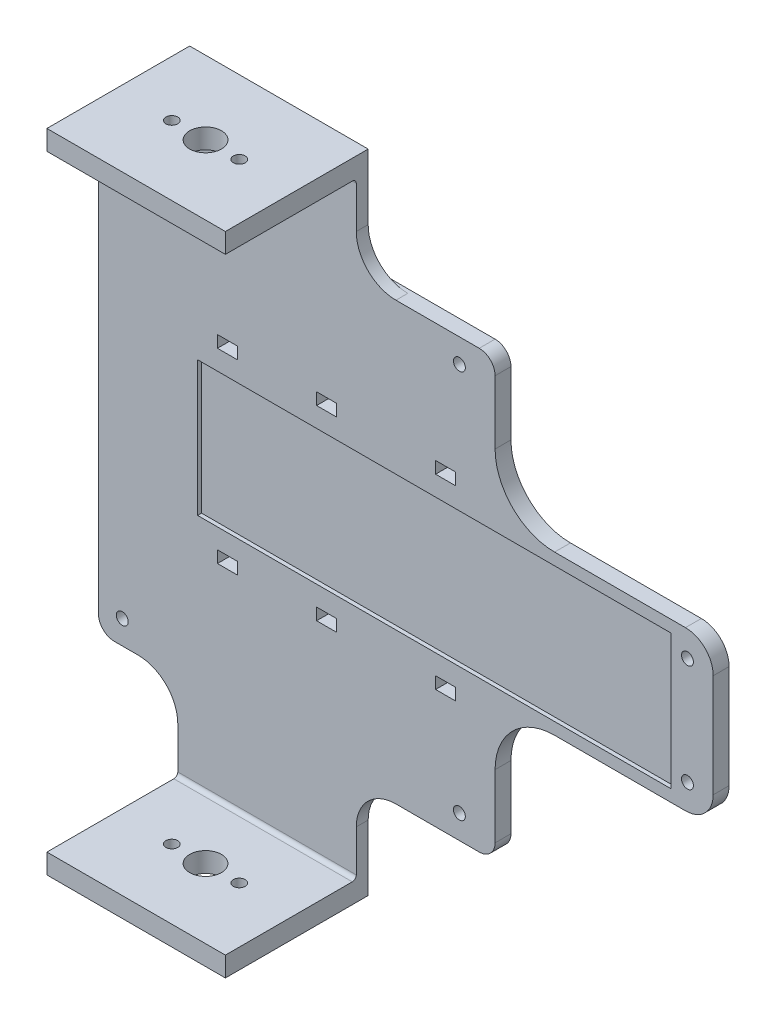
from build123d import *

# Parameters (mm, degrees)
SKETCH1_W           = 155
SKETCH1_H           = 110
BOSS_EXTRUDE1_DEPTH = 4
SKETCH2_W           = 55
SKETCH2_H           = 35
SKETCH2_R           = 1.5
CUT_EXTRUDE1_DEPTH  = 148
FILLET2_R           = 15
FILLET3_R           = 7
SKETCH3_W           = 45
SKETCH3_H           = 26.5
BOSS_EXTRUDE2_DEPTH = 3
SKETCH5_W           = 45
SKETCH5_H           = 5
BOSS_EXTRUDE3_DEPTH = 33
SKETCH6_R           = 4
SKETCH6_R_2         = 1.5
CUT_EXTRUDE2_DEPTH  = 223
FILLET4_R           = 10
FILLET5_R           = 1
SKETCH9_W           = 119.31184044
SKETCH9_H           = 34
CUT_EXTRUDE4_DEPTH  = 1
FILLET8_R           = 4
SKETCH10_W          = 5
SKETCH10_H          = 3
CUT_EXTRUDE5_DEPTH  = 4


with BuildPart() as part:
    # Sketch1 → Boss-Extrude1 (new body)
    with BuildSketch(Plane.XY):
        Rectangle(SKETCH1_W, SKETCH1_H)
    extrude(amount=BOSS_EXTRUDE1_DEPTH)

    # Sketch2 → Cut-Extrude1 (cut)
    with BuildSketch(Plane.XY.offset(4)):
        with Locations((50, -37.5)):
            Rectangle(SKETCH2_W, SKETCH2_H)
        with Locations((50, 37.5)):
            Rectangle(SKETCH2_W, SKETCH2_H)
        with Locations((-71.5, 49)):
            Circle(SKETCH2_R)
        with Locations(Location((-71.5, -49, 0), (0, 0, 180))):
            Circle(SKETCH2_R)
        with Locations((71, 13.5)):
            Circle(SKETCH2_R)
        with Locations(Location((71, -13.5, 0), (0, 0, 180))):
            Circle(SKETCH2_R)
        with Locations((13.5, 49)):
            Circle(SKETCH2_R)
        with Locations(Location((13.5, -49, 0), (0, 0, 180))):
            Circle(SKETCH2_R)
    extrude(amount=-CUT_EXTRUDE1_DEPTH, mode=Mode.SUBTRACT)

    # Fillet2
    fillet2_edges = [part.edges().sort_by_distance(p)[0] for p in [
        (22.5, 20, 2),
        (22.5, -20, 2),
    ]]
    fillet(fillet2_edges, radius=FILLET2_R)

    # Fillet3
    fillet3_edges = [part.edges().sort_by_distance(p)[0] for p in [
        (77.5, 20, 2),
        (77.5, -20, 2),
    ]]
    fillet(fillet3_edges, radius=FILLET3_R)

    # Sketch3 → Boss-Extrude2 (add)
    with BuildSketch(Plane.XY.offset(4)):
        with Locations((-35, 68.25)):
            Rectangle(SKETCH3_W, SKETCH3_H)
        with Locations((-35, -68.25)):
            Rectangle(SKETCH3_W, SKETCH3_H)
    extrude(amount=-BOSS_EXTRUDE2_DEPTH)

    # Sketch5 → Boss-Extrude3 (add)
    with BuildSketch(Plane.XY.offset(4)):
        with Locations((-35, 79)):
            Rectangle(SKETCH5_W, SKETCH5_H)
        with Locations((-35, -79)):
            Rectangle(SKETCH5_W, SKETCH5_H)
    extrude(amount=BOSS_EXTRUDE3_DEPTH)

    # Sketch6 → Cut-Extrude2 (cut)
    with BuildSketch(Plane(origin=(0, 81.5, 0), x_dir=(1, 0, 0), z_dir=(0, 1, 0))):
        with Locations(Location((-35, -19.5, 0), (0, 0, 270))):
            Circle(SKETCH6_R)
        with Locations(Location((-43.5, -19.5, 0), (0, 0, 270))):
            Circle(SKETCH6_R_2)
        with Locations(Location((-26.5, -19.5, 0), (0, 0, 270))):
            Circle(SKETCH6_R_2)
    extrude(amount=-CUT_EXTRUDE2_DEPTH, mode=Mode.SUBTRACT)

    # Fillet4
    fillet4_edges = [part.edges().sort_by_distance(p)[0] for p in [
        (-12.5, 55, 2.5),
        (-57.5, 55, 2.5),
        (-57.5, -55, 2.5),
        (-12.5, -55, 2.5),
    ]]
    fillet(fillet4_edges, radius=FILLET4_R)

    # Fillet5
    fillet5_edges = [part.edges().sort_by_distance(p)[0] for p in [
        (-35, 76.5, 4),
        (-35, -76.5, 4),
    ]]
    fillet(fillet5_edges, radius=FILLET5_R)

    # Sketch9 → Cut-Extrude4 (cut)
    with BuildSketch(Plane.XY.offset(4)):
        with Locations((7.15592022, 0)):
            Rectangle(SKETCH9_W, SKETCH9_H)
    extrude(amount=-CUT_EXTRUDE4_DEPTH, mode=Mode.SUBTRACT)

    # Fillet8
    fillet8_edges = [part.edges().sort_by_distance(p)[0] for p in [
        (22.5, 55, 2),
        (22.5, -55, 2),
        (-77.5, 55, 2),
        (-77.5, -55, 2),
    ]]
    fillet(fillet8_edges, radius=FILLET8_R)

    # Sketch10 → Cut-Extrude5 (cut)
    with BuildSketch(Plane.XY.offset(4)):
        with Locations((-45, 23.5)):
            Rectangle(SKETCH10_W, SKETCH10_H)
        with Locations((-20, 23.5)):
            Rectangle(SKETCH10_W, SKETCH10_H)
        with Locations((10, 23.5)):
            Rectangle(SKETCH10_W, SKETCH10_H)
        with Locations((10, -23.5)):
            Rectangle(SKETCH10_W, SKETCH10_H)
        with Locations((-20, -23.5)):
            Rectangle(SKETCH10_W, SKETCH10_H)
        with Locations((-45, -23.5)):
            Rectangle(SKETCH10_W, SKETCH10_H)
    extrude(amount=-CUT_EXTRUDE5_DEPTH, mode=Mode.SUBTRACT)


solid = part.part
